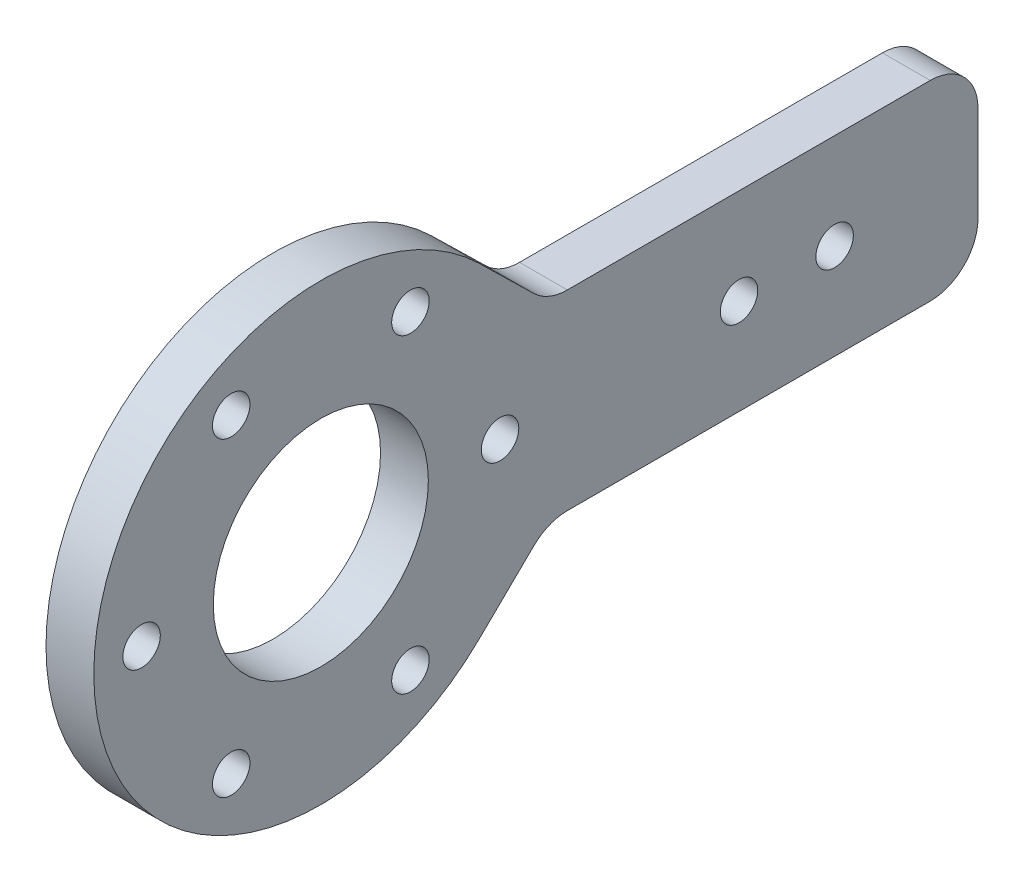
from build123d import *

# Parameters (mm, degrees)
SKETCH1_R           = 2.4892
SKETCH1_R_2         = 14.2875
BOSS_EXTRUDE1_DEPTH = 3.175
FILLET1_R           = 6.35


with BuildPart() as part:
    # Sketch1 → Boss-Extrude1 (new, symmetric)
    with BuildSketch(Plane(origin=(0, 0, 0), x_dir=(0, 0, -1), z_dir=(1, 0, 0))):
        with BuildLine():
            Line((21.078264706, -21.575058824), (30.1625, -12.7))
            Line((30.1625, -12.7), (87.3125, -12.7))
            Line((87.3125, -12.7), (87.3125, 12.7))
            Line((87.3125, 12.7), (30.1625, 12.7))
            Line((30.1625, 12.7), (21.078264706, 21.575058824))
            ThreePointArc((21.078264706, 21.575058824), (-30.1625, 0), (21.078264706, -21.575058824))
        make_face()
        with Locations((55.5625, 0)):
            Circle(SKETCH1_R, mode=Mode.SUBTRACT)
        with Locations((68.2625, 0)):
            Circle(SKETCH1_R, mode=Mode.SUBTRACT)
        with Locations((-11.90625, 20.622229928)):
            Circle(SKETCH1_R, mode=Mode.SUBTRACT)
        with Locations((11.90625, 20.622229928)):
            Circle(SKETCH1_R, mode=Mode.SUBTRACT)
        with Locations((-11.90625, -20.622229928)):
            Circle(SKETCH1_R, mode=Mode.SUBTRACT)
        with Locations((11.90625, -20.622229928)):
            Circle(SKETCH1_R, mode=Mode.SUBTRACT)
        with Locations((-23.8125, 0)):
            Circle(SKETCH1_R, mode=Mode.SUBTRACT)
        Circle(SKETCH1_R_2, mode=Mode.SUBTRACT)
        with Locations((23.8125, 0)):
            Circle(SKETCH1_R, mode=Mode.SUBTRACT)
    extrude(amount=BOSS_EXTRUDE1_DEPTH, both=True)

    # Fillet1
    fillet1_edges = [part.edges().sort_by_distance(p)[0] for p in [
        (0, 12.7, -30.1625),
        (0, 12.7, -87.3125),
        (0, -12.7, -87.3125),
        (0, -12.7, -30.1625),
    ]]
    fillet(fillet1_edges, radius=FILLET1_R)


solid = part.part
